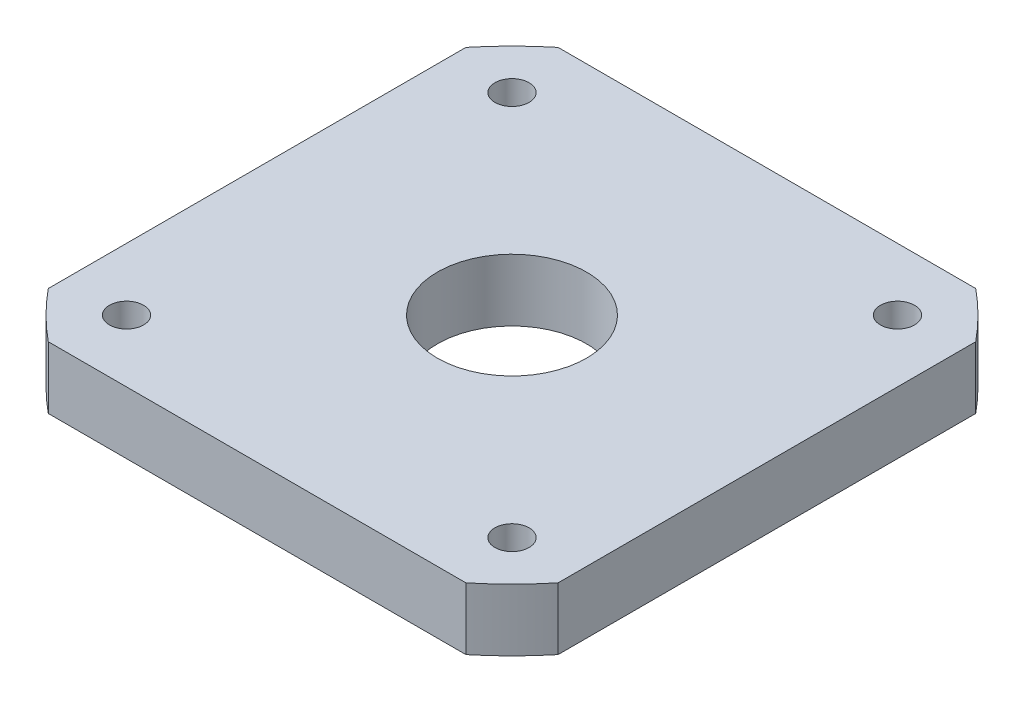
from build123d import *

# Parameters (mm, degrees)
SKETCH1_R           = 6
SKETCH1_R_2         = 1.375
BOSS_EXTRUDE1_DEPTH = 5


with BuildPart() as part:
    # Sketch1 → Boss-Extrude1 (new body)
    with BuildSketch(Plane(origin=(0, -13.739727311, 0), x_dir=(1, 0, 0), z_dir=(0, 1, 0))):
        with BuildLine():
            Line((16.292855624, 20.5), (-17.292855624, 20.5))
            ThreePointArc((-17.292855624, 20.5), (-19.238329701, 18.738329701), (-21, 16.792855624))
            Line((-21, 16.792855624), (-21, -16.792855624))
            ThreePointArc((-21, -16.792855624), (-19.238329701, -18.738329701), (-17.292855624, -20.5))
            Line((-17.292855624, -20.5), (16.292855624, -20.5))
            ThreePointArc((16.292855624, -20.5), (18.238329701, -18.738329701), (20, -16.792855624))
            Line((20, -16.792855624), (20, 16.792855624))
            ThreePointArc((20, 16.792855624), (18.238329701, 18.738329701), (16.292855624, 20.5))
        make_face()
        with Locations(Location((-0.5, 0, 0), (0, 0, 270))):
            Circle(SKETCH1_R, mode=Mode.SUBTRACT)
        with Locations(Location((-16, 15.5, 0), (0, 0, 270))):
            Circle(SKETCH1_R_2, mode=Mode.SUBTRACT)
        with Locations(Location((15, 15.5, 0), (0, 0, 270))):
            Circle(SKETCH1_R_2, mode=Mode.SUBTRACT)
        with Locations(Location((-16, -15.5, 0), (0, 0, 270))):
            Circle(SKETCH1_R_2, mode=Mode.SUBTRACT)
        with Locations(Location((15, -15.5, 0), (0, 0, 270))):
            Circle(SKETCH1_R_2, mode=Mode.SUBTRACT)
    extrude(amount=BOSS_EXTRUDE1_DEPTH)


solid = part.part
